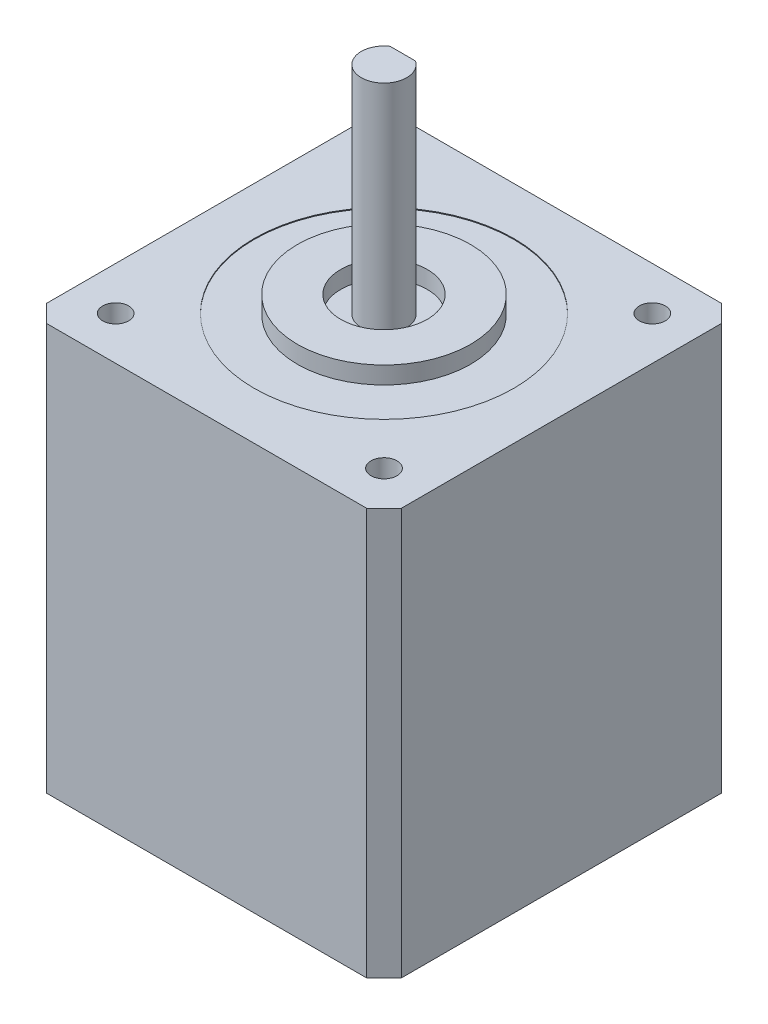
from build123d import *

# Parameters (mm, degrees)
BOSS_EXTRUDE1_DEPTH          = 47
SKETCH2_R                    = 15
CUT_EXTRUDE1_DEPTH           = 0.1
SKETCH3_R                    = 10
SKETCH3_R_2                  = 5
BOSS_EXTRUDE2_DEPTH          = 2
BOSS_EXTRUDE3_DEPTH          = 25
F_3_0_3_DIAMETER_HOLE1_D     = 3
F_3_0_3_DIAMETER_HOLE1_DEPTH = 5
F_3_0_3_DIAMETER_HOLE1_TIP   = 0.901290929


with BuildPart() as part:
    # Sketch1 → Boss-Extrude1 (new body)
    with BuildSketch(Plane(origin=(0, 0, 0), x_dir=(1, 0, 0), z_dir=(0, 1, 0))):
        Polygon((-20.5, 18.5), (-18.5, 20.5), (18.5, 20.5), (20.5, 18.5), (20.5, -18.5), (18.5, -20.5), (-18.5, -20.5), (-20.5, -18.5), align=None)
    extrude(amount=BOSS_EXTRUDE1_DEPTH)

    # Sketch2 → Cut-Extrude1 (cut)
    with BuildSketch(Plane(origin=(0, 47, 0), x_dir=(-1, 0, 0), z_dir=(0, 1, 0))):
        Circle(SKETCH2_R)
    extrude(amount=-CUT_EXTRUDE1_DEPTH, mode=Mode.SUBTRACT)

    # Sketch3 → Boss-Extrude2 (add)
    with BuildSketch(Plane(origin=(0, 46.9, 0), x_dir=(1, 0, 0), z_dir=(0, 1, 0))):
        Circle(SKETCH3_R)
        Circle(SKETCH3_R_2, mode=Mode.SUBTRACT)
    extrude(amount=BOSS_EXTRUDE2_DEPTH)

    # Sketch4 → Boss-Extrude3 (add)
    with BuildSketch(Plane(origin=(0, 46.9, 0), x_dir=(1, 0, 0), z_dir=(0, 1, 0))):
        with BuildLine():
            Line((-1.470984161, 2.175359116), (1.470984161, 2.175359116))
            ThreePointArc((1.470984161, 2.175359116), (0, -2.626020123), (-1.470984161, 2.175359116))
        make_face()
    extrude(amount=BOSS_EXTRUDE3_DEPTH)

    # Ø3.0 (3) Diameter Hole1
    with Locations(Plane(origin=(0, 47, 0), x_dir=(-1, 0, 0), z_dir=(0, 1, 0))):
        with Locations((-15.5, -15.5), (15.5, -15.5), (15.5, 15.5), (-15.5, 15.5)):
            Hole(F_3_0_3_DIAMETER_HOLE1_D / 2, depth=F_3_0_3_DIAMETER_HOLE1_DEPTH)
            with Locations((0, 0, -(F_3_0_3_DIAMETER_HOLE1_DEPTH + F_3_0_3_DIAMETER_HOLE1_TIP / 2))):  # 118° drill point
                Cone(0, F_3_0_3_DIAMETER_HOLE1_D / 2, F_3_0_3_DIAMETER_HOLE1_TIP, mode=Mode.SUBTRACT)


solid = part.part
